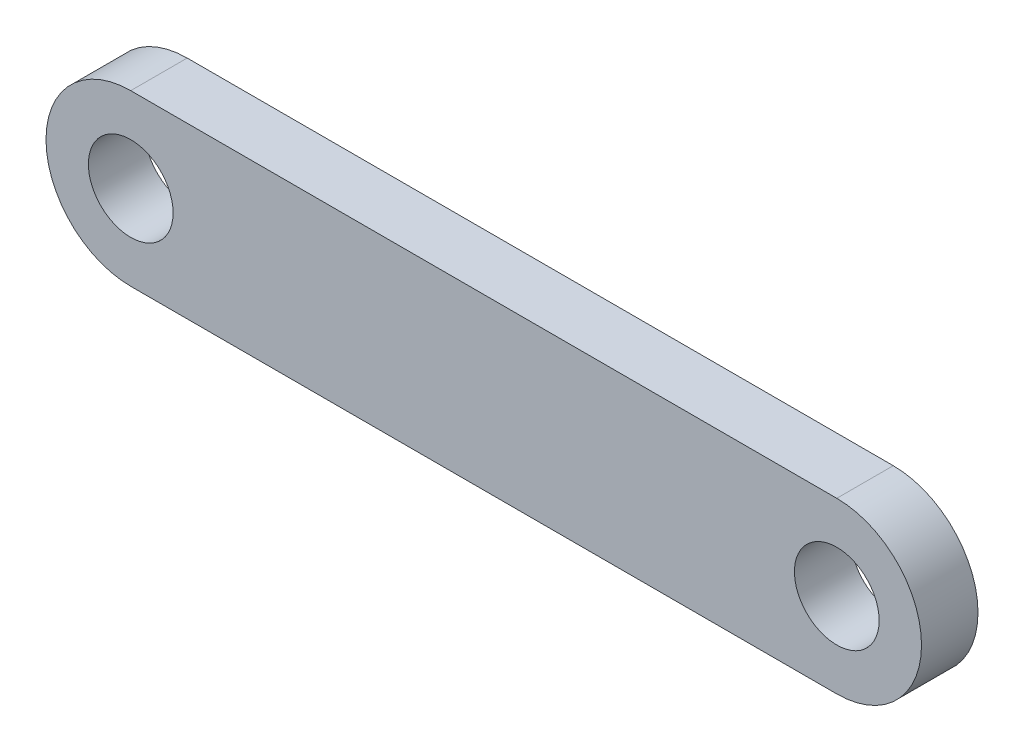
from build123d import *

# Parameters (mm, degrees)
ESQUISSE1_R             = 1.5
BOSS_EXTRU_1_DEPTH      = 4
ESQUISSE1_4_R           = 1.5
ENL_V_MAT_EXTRU_1_DEPTH = 2


with BuildPart() as part:
    # Esquisse1 → Boss.-Extru.1 (new body)
    with BuildSketch(Plane.XY):
        with BuildLine():
            Line((25, 3), (0, 3))
            ThreePointArc((0, 3), (-3, 0), (0, -3))
            Line((0, -3), (25, -3))
            ThreePointArc((25, -3), (28, 0), (25, 3))
        make_face()
        Circle(ESQUISSE1_R, mode=Mode.SUBTRACT)
        with Locations((25, 0)):
            Circle(ESQUISSE1_R, mode=Mode.SUBTRACT)
    extrude(amount=BOSS_EXTRU_1_DEPTH)

    # Esquisse1<4> → Enlèv. mat.-Extru.1 (cut)
    with BuildSketch(Plane.XY):
        with BuildLine():
            Line((25, 3), (0, 3))
            ThreePointArc((0, 3), (-3, 0), (0, -3))
            Line((0, -3), (25, -3))
            ThreePointArc((25, -3), (28, 0), (25, 3))
        make_face()
        Circle(ESQUISSE1_4_R, mode=Mode.SUBTRACT)
        with Locations((25, 0)):
            Circle(ESQUISSE1_4_R, mode=Mode.SUBTRACT)
    extrude(amount=ENL_V_MAT_EXTRU_1_DEPTH, mode=Mode.SUBTRACT)


solid = part.part
